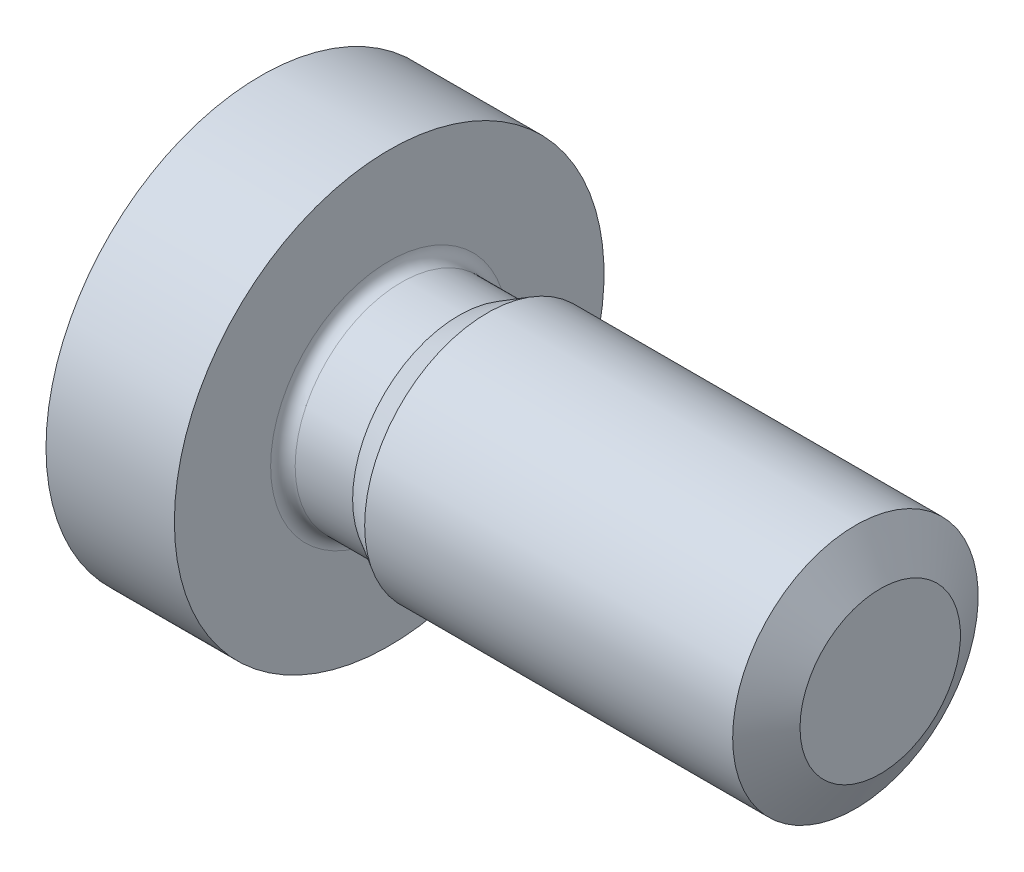
from build123d import *

# Parameters (mm, degrees)
FILLET_1_R               = 0.1
PATTERN_CIRCULAR_1_COUNT = 2
PATTERN_CIRCULAR_1_ANGLE = 90


with BuildPart() as part:
    # 草图1 → Revolve 816 (revolve)
    with BuildSketch(Plane.XY, mode=Mode.PRIVATE) as revolve_816_sk:
        with BuildLine():
            Line((0, 0), (5.4, 0))
            Line((5.4, 0), (5.4, 1))
            Line((5.4, 1), (2.2, 1))
            Line((2.2, 1), (1.967905192, 0.866))
            Line((1.967905192, 0.866), (1.4, 0.866))
            Line((1.4, 0.866), (1.4, 1.75))
            Line((1.4, 1.75), (0.354219012, 1.75))
            ThreePointArc((0.354219012, 1.75), (0.089443661, 0.89274452), (0, 0))
        make_face()
    revolve(revolve_816_sk.sketch.rotate(Axis((-0.437242634, 0, 0), (1, 0, 0)), 90), axis=Axis((-0.437242634, 0, 0), (1, 0, 0)))

    # 圆角1
    fillet_1_edges = [part.edges().sort_by_distance(p)[0] for p in [
        (1.4, 0, -0.866),
    ]]
    fillet(fillet_1_edges, radius=FILLET_1_R)

    # 草图2 → 切除-放样1 section 0
    with BuildSketch(Plane(origin=(0, 0, 0), x_dir=(0, 0, -1), z_dir=(1, 0, 0)), mode=Mode.PRIVATE) as loft_1_s0:
        with BuildLine():
            Line((0.2, 1.1), (-0.2, 1.1))
            Line((-0.2, 1.1), (-0.2, -1.1))
            Line((-0.2, -1.1), (0.2, -1.1))
            Line((0.2, -1.1), (0.2, 1.1))
        make_face()
    loft_1 = loft([loft_1_s0.sketch, Vertex(1.01, 0, 0)], mode=Mode.SUBTRACT)

    # 阵列(圆周)1: 切除-放样1 ×2 about axis
    pattern_circular_1_axis = Axis((0, 0, 0), (1, 0, 0))
    for i in range(1, PATTERN_CIRCULAR_1_COUNT):
        add(loft_1.rotate(pattern_circular_1_axis, i * PATTERN_CIRCULAR_1_ANGLE / (PATTERN_CIRCULAR_1_COUNT - 1)), mode=Mode.SUBTRACT)

    # 草图4 → 切除-旋转1 (revolve, cut)
    with BuildSketch(Plane.XY, mode=Mode.PRIVATE) as cut_revolve_1_sk:
        Polygon((5.197833598, 1), (5.597833598, 1), (5.4, 0.6536), align=None)
    revolve(cut_revolve_1_sk.sketch.rotate(Axis((4.77468063, 0, 0), (1, 0, 0)), 90), axis=Axis((4.77468063, 0, 0), (1, 0, 0)), mode=Mode.SUBTRACT)


solid = part.part
